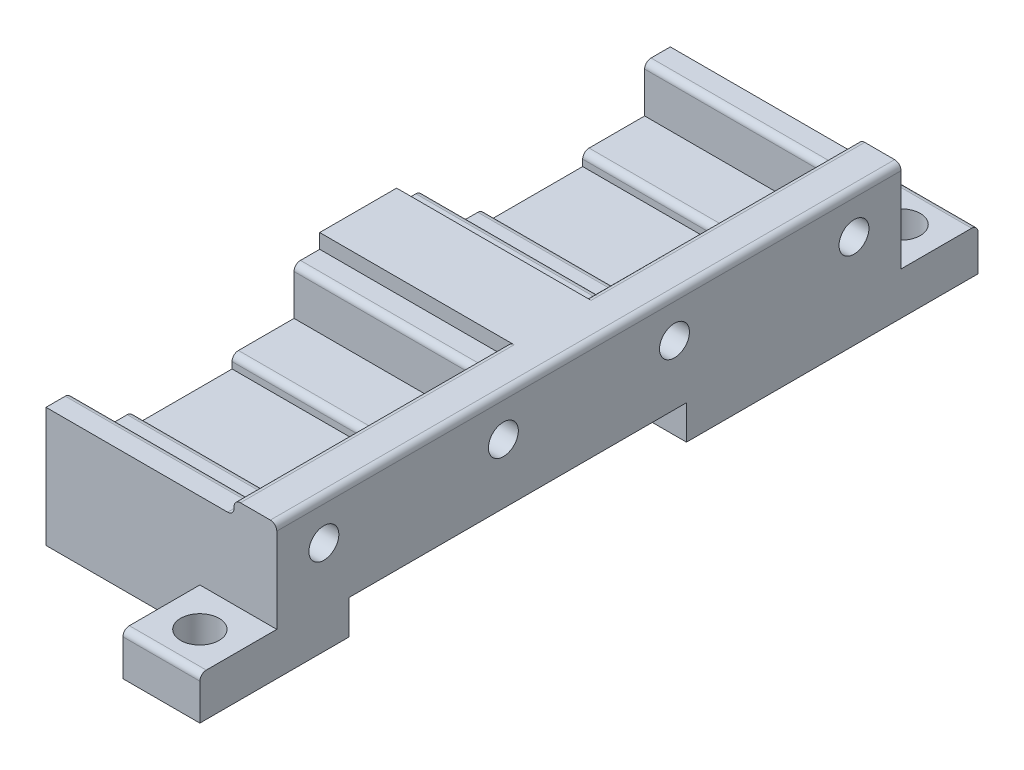
from build123d import *

# Parameters (mm, degrees)
BOSS_EXTRUDE1_DEPTH = 11
SKETCH3_W           = 22
SKETCH3_H           = 3
BOSS_EXTRUDE2_DEPTH = 14
BOSS_EXTRUDE3_DEPTH = 5
SKETCH5_R           = 1.75
CUT_EXTRUDE1_DEPTH  = 36.096650541
SKETCH6_W           = 9
SKETCH6_H           = 9
BOSS_EXTRUDE4_DEPTH = 5
SKETCH10_R          = 2.25
CUT_EXTRUDE2_DEPTH  = 34.584744739
SKETCH8_W           = 27
SKETCH8_H           = 15.7
BOSS_EXTRUDE5_DEPTH = 4.5
FILLET1_R           = 0.75
CUT_EXTRUDE3_DEPTH  = 4
SKETCH12_R          = 1.5
CUT_EXTRUDE4_DEPTH  = 2


with BuildPart() as part:
    # Sketch1 → Boss-Extrude1 (new, symmetric)
    with BuildSketch(Plane(origin=(0, 0, 0), x_dir=(0, 0, -1), z_dir=(1, 0, 0))):
        Polygon((-13.0089, 0), (13.0089, 0), (13.0089, 8.5), (5.7589, 8.5), (5.7589, 7), (-5.7589, 7), (-5.7589, 8.5), (-13.0089, 8.5), align=None)
    extrude(amount=BOSS_EXTRUDE1_DEPTH, both=True)

    # Sketch3 → Boss-Extrude2 (add)
    with BuildSketch(Plane.XZ):
        with Locations((0, -14.5089)):
            Rectangle(SKETCH3_W, SKETCH3_H)
        with Locations((0, 14.5089)):
            Rectangle(SKETCH3_W, SKETCH3_H)
    extrude(amount=-BOSS_EXTRUDE2_DEPTH)

    # Sketch4 → Boss-Extrude3 (add)
    with BuildSketch(Plane(origin=(11, 0, 0), x_dir=(0, 0, -1), z_dir=(1, 0, 0))):
        Polygon((-8.8, 15.7), (-16.0089, 15.7), (-16.0089, 0), (16.0089, 0), (16.0089, 15.7), align=None)
    extrude(amount=BOSS_EXTRUDE3_DEPTH)

    # Sketch5 → Cut-Extrude1 (cut, through all)
    with BuildSketch(Plane(origin=(16, 0, 0), x_dir=(0, 0, -1), z_dir=(1, 0, 0))):
        with Locations((-10.5, 11)):
            Circle(SKETCH5_R)
        with Locations((10.5, 11)):
            Circle(SKETCH5_R)
    extrude(amount=-CUT_EXTRUDE1_DEPTH, mode=Mode.SUBTRACT)

    # Sketch6 → Boss-Extrude4 (add)
    with BuildSketch(Plane.XZ):
        with Locations((11.5, 20.5089)):
            Rectangle(SKETCH6_W, SKETCH6_H)
    extrude(amount=-BOSS_EXTRUDE4_DEPTH)

    # Sketch10 → Cut-Extrude2 (cut, through all)
    with BuildSketch(Plane.XZ):
        with Locations(Location((11.5, 20.5089, 0), (0, 0, 270))):
            Circle(SKETCH10_R)
    extrude(amount=-CUT_EXTRUDE2_DEPTH, mode=Mode.SUBTRACT)

    # Sketch8 → Boss-Extrude5 (add)
    with BuildSketch(Plane(origin=(0, 0, -16.0089), x_dir=(-1, 0, 0), z_dir=(0, 0, -1))):
        with Locations((-2.5, 7.85)):
            Rectangle(SKETCH8_W, SKETCH8_H)
    extrude(amount=BOSS_EXTRUDE5_DEPTH)

    # Fillet1
    fillet1_edges = [part.edges().sort_by_distance(p)[0] for p in [
        (0, 8.5, 5.7589),
        (0, 8.5, -5.7589),
        (0, 14, -13.0089),
        (11, 14, -14.5089),
        (11, 11.25, -13.0089),
        (11, 14, 14.5089),
        (11, 11.25, 13.0089),
        (0, 14, 13.0089),
        (11, 15.7, 0),
        (16, 15.7, -2.25),
        (11.5, 5, 25.0089),
    ]]
    fillet(fillet1_edges, radius=FILLET1_R)

    # Mirror6: part across plane


with BuildPart() as part_1:
    add(part.part)
    add(part.part.mirror(Plane(origin=(0, 0, -20.5089), x_dir=(1, 0, 0), z_dir=(0, 0, -1))))

    # Sketch11 → Cut-Extrude3 (cut)
    with BuildSketch(Plane.XZ):
        Polygon((0.65, 7.5789), (16, 7.5789), (16, -31.9211), (-11, -31.9211), (-11, 7.5789), align=None)
    extrude(amount=-CUT_EXTRUDE3_DEPTH, mode=Mode.SUBTRACT)

    # Sketch12 → Cut-Extrude4 (cut)
    with BuildSketch(Plane.XZ.offset(-4)):
        with Locations(Location((0.65, -12.1711, 0), (0, 0, 270))):
            Circle(SKETCH12_R)
    extrude(amount=-CUT_EXTRUDE4_DEPTH, mode=Mode.SUBTRACT)


solid = part_1.part
